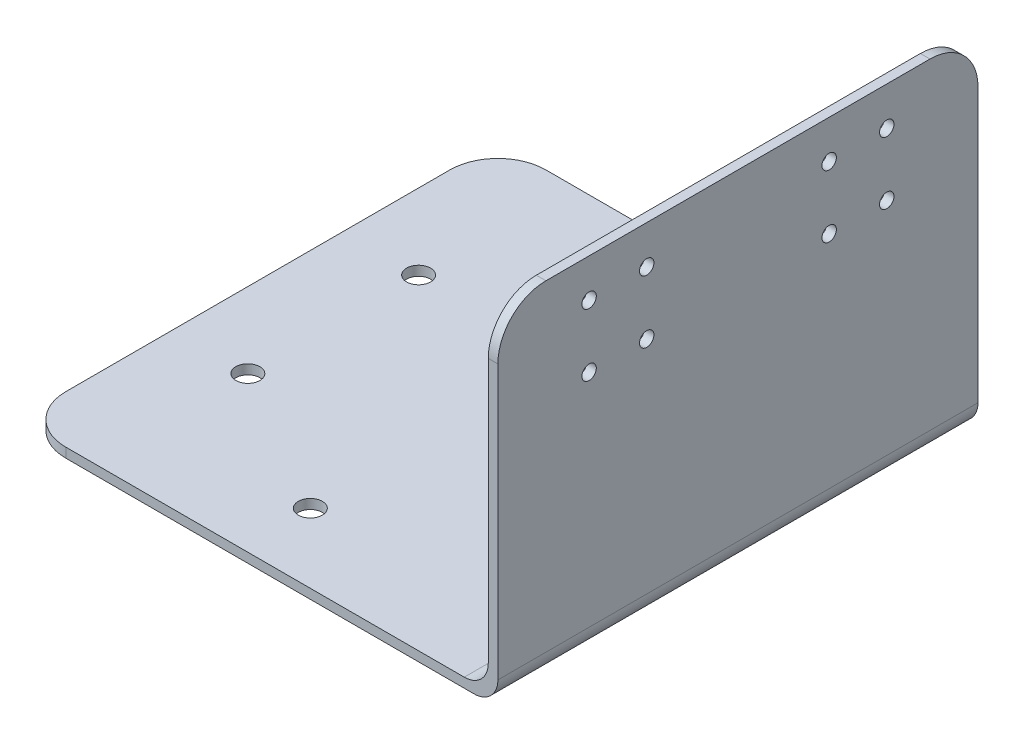
from build123d import *

# Parameters (mm, degrees)
BOSS_EXTRUDE1_DEPTH = 100
SKETCH2_R           = 1.5
CUT_EXTRUDE1_DEPTH  = 148.692247596
SKETCH3_R           = 2.5
CUT_EXTRUDE2_DEPTH  = 158.165517847
FILLET1_R           = 10


with BuildPart() as part:
    # Sketch1 → Boss-Extrude1 (new body)
    with BuildSketch(Plane.XY):
        with BuildLine():
            Line((-1, 25), (1, 25))
            Line((1, 25), (1, -42))
            ThreePointArc((1, -42), (-0.464466094, -45.535533906), (-4, -47))
            Line((-4, -47), (-99, -47))
            Line((-99, -47), (-99, -45))
            Line((-99, -45), (-6, -45))
            ThreePointArc((-6, -45), (-2.464466094, -43.535533906), (-1, -40))
            Line((-1, -40), (-1, 25))
        make_face()
    extrude(amount=BOSS_EXTRUDE1_DEPTH)

    # Sketch2 → Cut-Extrude1 (cut, through all)
    with BuildSketch(Plane.ZY.offset(1)):
        with Locations(Location((19, 4, 0), (0, 0, 270))):
            Circle(SKETCH2_R)
        with Locations(Location((31, 4, 0), (0, 0, 270))):
            Circle(SKETCH2_R)
        with Locations(Location((31, 17, 0), (0, 0, 270))):
            Circle(SKETCH2_R)
        with Locations(Location((19, 17, 0), (0, 0, 270))):
            Circle(SKETCH2_R)
        with Locations(Location((81, 17, 0), (0, 0, 90))):
            Circle(SKETCH2_R)
        with Locations(Location((69, 17, 0), (0, 0, 90))):
            Circle(SKETCH2_R)
        with Locations(Location((69, 4, 0), (0, 0, 90))):
            Circle(SKETCH2_R)
        with Locations(Location((81, 4, 0), (0, 0, 90))):
            Circle(SKETCH2_R)
    extrude(amount=-CUT_EXTRUDE1_DEPTH, mode=Mode.SUBTRACT)

    # Sketch3 → Cut-Extrude2 (cut, through all)
    with BuildSketch(Plane(origin=(0, -45, 0), x_dir=(1, 0, 0), z_dir=(0, 1, 0))):
        with Locations(Location((-21.704136641, -32.22, 0), (0, 0, 180))):
            Circle(SKETCH3_R)
        with Locations(Location((-21.704136641, -67.78, 0), (0, 0, 180))):
            Circle(SKETCH3_R)
        with Locations(Location((-52.5, -85.56, 0), (0, 0, 180))):
            Circle(SKETCH3_R)
        with Locations(Location((-83.295863359, -67.78, 0), (0, 0, 180))):
            Circle(SKETCH3_R)
        with Locations(Location((-83.295863359, -32.22, 0), (0, 0, 180))):
            Circle(SKETCH3_R)
        with Locations(Location((-52.5, -14.44, 0), (0, 0, 180))):
            Circle(SKETCH3_R)
    extrude(amount=-CUT_EXTRUDE2_DEPTH, mode=Mode.SUBTRACT)

    # Fillet1
    fillet1_edges = [part.edges().sort_by_distance(p)[0] for p in [
        (-99, -46, 0),
        (-99, -46, 100),
        (0, 25, 100),
        (0, 25, 0),
    ]]
    fillet(fillet1_edges, radius=FILLET1_R)


solid = part.part
